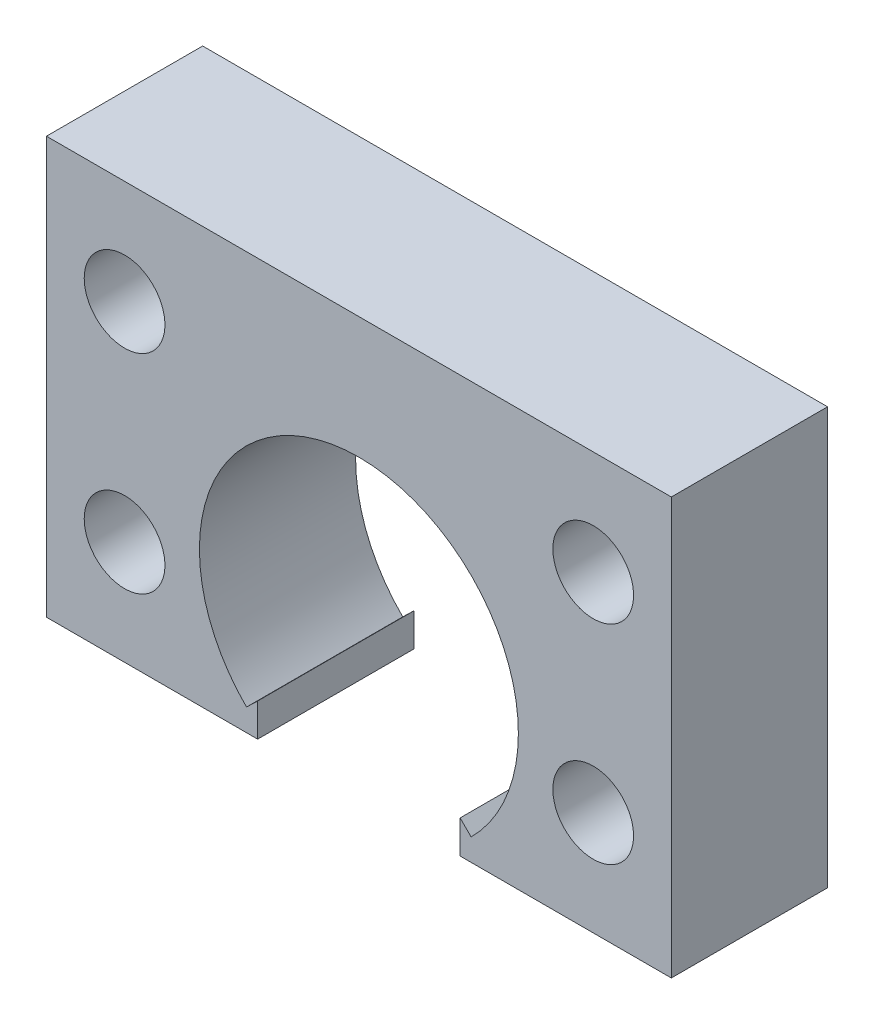
from build123d import *

# Parameters (mm, degrees)
SZKIC1_W                    = 24
SZKIC1_H                    = 16
DODANIE_WYCI_GNI_CIE1_DEPTH = 6
WYTNIJ_WYCI_GNI_CIE1_DEPTH  = 6
SZKIC3_R                    = 1.55
WYTNIJ_WYCI_GNI_CIE2_DEPTH  = 62.908035593


with BuildPart() as part:
    # Szkic1 → Dodanie-wyciągnięcie1 (new body)
    with BuildSketch(Plane.XY):
        with Locations((47.502982034, -8)):
            Rectangle(SZKIC1_W, SZKIC1_H)
    extrude(amount=-DODANIE_WYCI_GNI_CIE1_DEPTH)

    # Szkic2 → Wytnij-wyciągnięcie1 (cut)
    with BuildSketch(Plane.XY.offset(-6)):
        with BuildLine():
            Line((43.614537615, -16), (43.614537615, -14.730541148))
            Line((43.614537615, -14.730541148), (43.186780246, -15.145805693))
            ThreePointArc((43.186780246, -15.145805693), (43.13517548, -15.093936528), (43.084193998, -15.041454619))
            ThreePointArc((43.084193998, -15.041454619), (47.502982034, -4.675), (51.921770071, -15.041454619))
            ThreePointArc((51.921770071, -15.041454619), (51.867648174, -15.097128633), (51.812824874, -15.152112096))
            Line((51.812824874, -15.152112096), (51.391426454, -14.730541148))
            Line((51.391426454, -14.730541148), (51.391426454, -16))
            Line((51.391426454, -16), (43.614537615, -16))
        make_face()
    extrude(amount=WYTNIJ_WYCI_GNI_CIE1_DEPTH, mode=Mode.SUBTRACT)

    # Szkic3 → Wytnij-wyciągnięcie2 (cut, through all)
    with BuildSketch(Plane(origin=(0, 0, -6), x_dir=(-1, 0, 0), z_dir=(0, 0, -1))):
        with Locations((-56.502982034, -12)):
            Circle(SZKIC3_R)
        with Locations((-56.502982034, -4)):
            Circle(SZKIC3_R)
        with Locations((-38.502982034, -4)):
            Circle(SZKIC3_R)
        with Locations((-38.502982034, -12)):
            Circle(SZKIC3_R)
    extrude(amount=-WYTNIJ_WYCI_GNI_CIE2_DEPTH, mode=Mode.SUBTRACT)


solid = part.part
